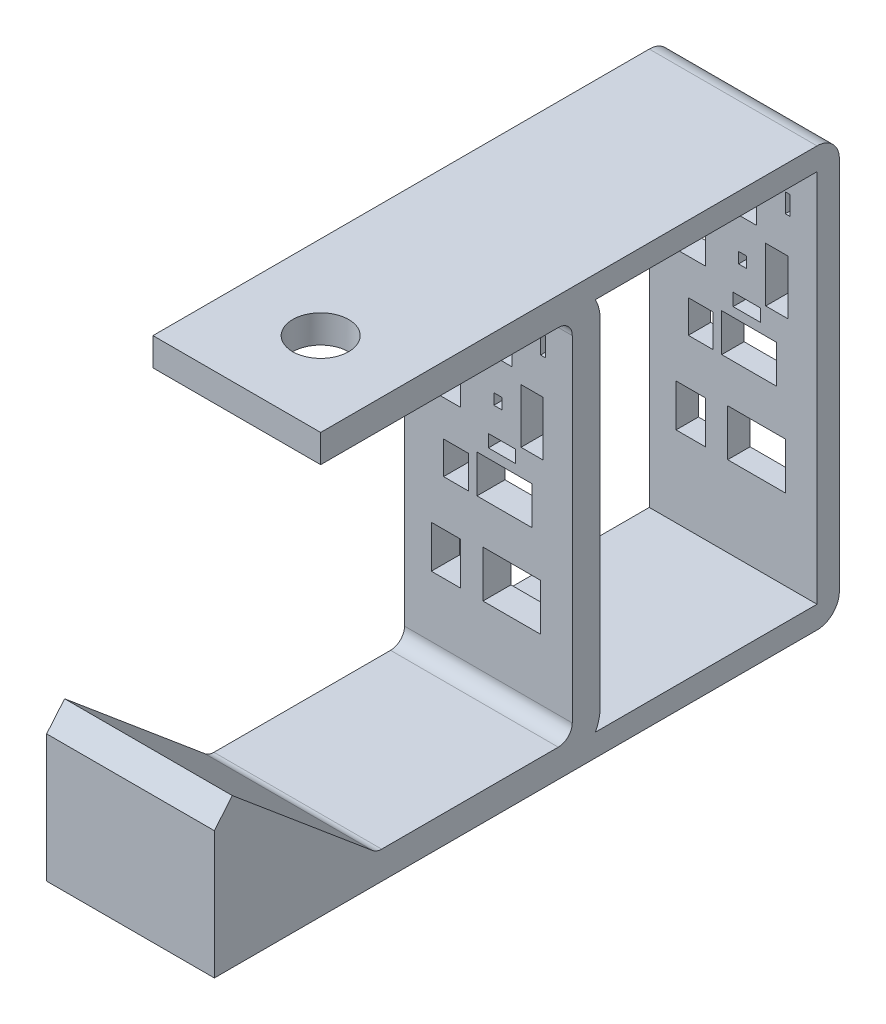
from build123d import *

# Parameters (mm, degrees)
BASE_EXTRUDE_THIN_DEPTH        = 19.05
CUT_EXTRUDE1_REACH             = 128.668
SKETCH2_R                      = 6.35
BOSS_EXTRUDE1_START            = -19.05
BOSS_EXTRUDE1_DEPTH            = 38.1
EXTRUDE_THIN1_DEPTH            = 38.1
CUT_EXTRUDE2_REACH             = 128.287
SKETCH4_W                      = 1.110971389
SKETCH4_H                      = 4.320444291
SKETCH4_W_2                    = 1.851618982
SKETCH4_H_2                    = 2.46882531
SKETCH4_W_3                    = 12.467567812
SKETCH4_H_3                    = 8.640888583
SKETCH4_W_4                    = 7.776799724
SKETCH4_H_4                    = 11.356596423
SKETCH4_W_5                    = 13.08477414
SKETCH4_H_5                    = 10.61594883
SKETCH4_W_6                    = 6.665828335
SKETCH4_H_6                    = 9.628418706
SKETCH4_W_7                    = 5.616577579
SKETCH4_H_7                    = 7.406475928
SKETCH4_W_8                    = 9.011212379
SKETCH4_H_8                    = 6.665828335
SKETCH4_W_9                    = 6.172063273
SKETCH4_H_9                    = 2.839149106
SKETCH4_W_10                   = 4.999371251
SKETCH4_H_10                   = 12.344126546
CUT_EXTRUDE2_DIRECTION_2_DEPTH = 127.286641978
FILLET1_R                      = 5.08


with BuildPart() as part:
    # Sketch1 → Base-Extrude-Thin (new, symmetric)
    with BuildSketch(Plane(origin=(0, 0, 0), x_dir=(0, 0, -1), z_dir=(1, 0, 0))):
        with BuildLine():
            Line((-77.216478592, 27.494340102), (-45.335245167, 0.742808893))
            ThreePointArc((-45.335245167, 0.742808893), (-44.380308461, 0.191475929), (-43.294394506, 0))
            Line((-43.294394506, 0), (-3.175, 0))
            ThreePointArc((-3.175, 0), (-0.92993597, 0.92993597), (0, 3.175))
            Line((0, 3.175), (0, 79.375))
            ThreePointArc((0, 79.375), (-0.92993597, 81.62006403), (-3.175, 82.55))
            Line((-3.175, 82.55), (-57.15, 82.55))
            Line((-57.15, 82.55), (-57.15, 88.9))
            Line((-57.15, 88.9), (-3.175, 88.9))
            ThreePointArc((-3.175, 88.9), (3.560192091, 86.110192091), (6.35, 79.375))
            Line((6.35, 79.375), (6.35, 3.175))
            ThreePointArc((6.35, 3.175), (3.560192091, -3.560192091), (-3.175, -6.35))
            Line((-3.175, -6.35), (-43.294394506, -6.35))
            ThreePointArc((-43.294394506, -6.35), (-46.552136371, -5.775572213), (-49.416946488, -4.121573321))
            Line((-49.416946488, -4.121573321), (-81.298179914, 22.629957888))
            Line((-81.298179914, 22.629957888), (-77.216478592, 27.494340102))
        make_face()
    extrude(amount=BASE_EXTRUDE_THIN_DEPTH, both=True)

    # Sketch2 → Cut-Extrude1 (cut, up to next)
    with BuildSketch(Plane(origin=(0, 88.9, 0), x_dir=(-1, 0, 0), z_dir=(0, 1, 0)), mode=Mode.PRIVATE) as cut_extrude1_sk1:
        with Locations(Location((0, 38.1, 0), (0, 0, 90))):
            Circle(SKETCH2_R)
    cut_extrude1_tool1 = extrude(cut_extrude1_sk1.sketch, amount=-CUT_EXTRUDE1_REACH, mode=Mode.PRIVATE) & part.part
    add(cut_extrude1_tool1.solids().sort_by_distance((0, 88.9, 38.1))[0], mode=Mode.SUBTRACT)

    # Sketch3 → Boss-Extrude1 (add)
    with BuildSketch(Plane(origin=(0, 0, 0), x_dir=(0, 0, -1), z_dir=(1, 0, 0)).offset(BOSS_EXTRUDE1_START)):
        with BuildLine():
            Line((-49.416946488, -4.121573321), (-81.298179914, 22.629957888))
            Line((-81.298179914, 22.629957888), (-81.298179914, -6.35))
            Line((-81.298179914, -6.35), (-43.294394506, -6.35))
            ThreePointArc((-43.294394506, -6.35), (-46.552136371, -5.775572213), (-49.416946488, -4.121573321))
        make_face()
    extrude(amount=BOSS_EXTRUDE1_DEPTH)

    # Sketch5 → Extrude-Thin1 (add, through all)
    with BuildSketch(Plane(origin=(19.05, 0, 0), x_dir=(0, 0, -1), z_dir=(1, 0, 0))):
        Polygon((-3.175, 88.9), (60.674508946, 88.9), (60.674508946, -6.35), (-3.175, -6.35), (-3.175, -1.27), (55.594508946, -1.27), (55.594508946, 83.82), (-3.175, 83.82), align=None)
    extrude(amount=-EXTRUDE_THIN1_DEPTH)

    # Sketch4 → Cut-Extrude2 (cut, up to next)
    with BuildSketch(Plane(origin=(0, 0, -6.35), x_dir=(-1, 0, 0), z_dir=(0, 0, -1)), mode=Mode.PRIVATE) as cut_extrude2_sk1:
        with Locations((-12.40584718, 74.110376614)):
            Rectangle(SKETCH4_W, SKETCH4_H)
    cut_extrude2_tool1 = extrude(cut_extrude2_sk1.sketch, amount=-CUT_EXTRUDE2_REACH, mode=Mode.PRIVATE) & part.part
    # Sketch4 → Cut-Extrude2 (cut, up to next)
    with BuildSketch(Plane(origin=(0, 0, -6.35), x_dir=(-1, 0, 0), z_dir=(0, 0, -1)), mode=Mode.PRIVATE) as cut_extrude2_sk2:
        with Locations((-2.160222146, 58.001291471)):
            Rectangle(SKETCH4_W_2, SKETCH4_H_2)
    cut_extrude2_tool2 = extrude(cut_extrude2_sk2.sketch, amount=-CUT_EXTRUDE2_REACH, mode=Mode.PRIVATE) & part.part
    # Sketch4 → Cut-Extrude2 (cut, up to next)
    with BuildSketch(Plane(origin=(0, 0, -6.35), x_dir=(-1, 0, 0), z_dir=(0, 0, -1)), mode=Mode.PRIVATE) as cut_extrude2_sk3:
        with Locations((-3.641517331, 41.336720633)):
            Rectangle(SKETCH4_W_3, SKETCH4_H_3)
    cut_extrude2_tool3 = extrude(cut_extrude2_sk3.sketch, amount=-CUT_EXTRUDE2_REACH, mode=Mode.PRIVATE) & part.part
    # Sketch4 → Cut-Extrude2 (cut, up to next)
    with BuildSketch(Plane(origin=(0, 0, -6.35), x_dir=(-1, 0, 0), z_dir=(0, 0, -1)), mode=Mode.PRIVATE) as cut_extrude2_sk4:
        with Locations((10.183904401, 58.248174002)):
            Rectangle(SKETCH4_W_4, SKETCH4_H_4)
    cut_extrude2_tool4 = extrude(cut_extrude2_sk4.sketch, amount=-CUT_EXTRUDE2_REACH, mode=Mode.PRIVATE) & part.part
    # Sketch4 → Cut-Extrude2 (cut, up to next)
    with BuildSketch(Plane(origin=(0, 0, -6.35), x_dir=(-1, 0, 0), z_dir=(0, 0, -1)), mode=Mode.PRIVATE) as cut_extrude2_sk5:
        with Locations((-5.307974415, 22.326765751)):
            Rectangle(SKETCH4_W_5, SKETCH4_H_5)
    cut_extrude2_tool5 = extrude(cut_extrude2_sk5.sketch, amount=-CUT_EXTRUDE2_REACH, mode=Mode.PRIVATE) & part.part
    # Sketch4 → Cut-Extrude2 (cut, up to next)
    with BuildSketch(Plane(origin=(0, 0, -6.35), x_dir=(-1, 0, 0), z_dir=(0, 0, -1)), mode=Mode.PRIVATE) as cut_extrude2_sk6:
        with Locations((9.628418706, 21.833000689)):
            Rectangle(SKETCH4_W_6, SKETCH4_H_6)
    cut_extrude2_tool6 = extrude(cut_extrude2_sk6.sketch, amount=-CUT_EXTRUDE2_REACH, mode=Mode.PRIVATE) & part.part
    # Sketch4 → Cut-Extrude2 (cut, up to next)
    with BuildSketch(Plane(origin=(0, 0, -6.35), x_dir=(-1, 0, 0), z_dir=(0, 0, -1)), mode=Mode.PRIVATE) as cut_extrude2_sk7:
        with Locations((7.375615612, 40.719514305)):
            Rectangle(SKETCH4_W_7, SKETCH4_H_7)
    cut_extrude2_tool7 = extrude(cut_extrude2_sk7.sketch, amount=-CUT_EXTRUDE2_REACH, mode=Mode.PRIVATE) & part.part
    # Sketch4 → Cut-Extrude2 (cut, up to next)
    with BuildSketch(Plane(origin=(0, 0, -6.35), x_dir=(-1, 0, 0), z_dir=(0, 0, -1)), mode=Mode.PRIVATE) as cut_extrude2_sk8:
        with Locations((-0.802368225, 69.728211691)):
            Rectangle(SKETCH4_W_8, SKETCH4_H_8)
    cut_extrude2_tool8 = extrude(cut_extrude2_sk8.sketch, amount=-CUT_EXTRUDE2_REACH, mode=Mode.PRIVATE) & part.part
    # Sketch4 → Cut-Extrude2 (cut, up to next)
    with BuildSketch(Plane(origin=(0, 0, -6.35), x_dir=(-1, 0, 0), z_dir=(0, 0, -1)), mode=Mode.PRIVATE) as cut_extrude2_sk9:
        with Locations((-3.086031637, 49.17524099)):
            Rectangle(SKETCH4_W_9, SKETCH4_H_9)
    cut_extrude2_tool9 = extrude(cut_extrude2_sk9.sketch, amount=-CUT_EXTRUDE2_REACH, mode=Mode.PRIVATE) & part.part
    # Sketch4 → Cut-Extrude2 (cut, up to next)
    with BuildSketch(Plane(origin=(0, 0, -6.35), x_dir=(-1, 0, 0), z_dir=(0, 0, -1)), mode=Mode.PRIVATE) as cut_extrude2_sk10:
        with Locations((-9.906161554, 57.75440894)):
            Rectangle(SKETCH4_W_10, SKETCH4_H_10)
    cut_extrude2_tool10 = extrude(cut_extrude2_sk10.sketch, amount=-CUT_EXTRUDE2_REACH, mode=Mode.PRIVATE) & part.part
    add(cut_extrude2_tool1.solids().sort_by_distance((12.405847, 74.110377, -6.35))[0], mode=Mode.SUBTRACT)
    add(cut_extrude2_tool2.solids().sort_by_distance((2.160222, 58.001291, -6.35))[0], mode=Mode.SUBTRACT)
    add(cut_extrude2_tool3.solids().sort_by_distance((3.641517, 41.336721, -6.35))[0], mode=Mode.SUBTRACT)
    add(cut_extrude2_tool4.solids().sort_by_distance((-10.183904, 58.248174, -6.35))[0], mode=Mode.SUBTRACT)
    add(cut_extrude2_tool5.solids().sort_by_distance((5.307974, 22.326766, -6.35))[0], mode=Mode.SUBTRACT)
    add(cut_extrude2_tool6.solids().sort_by_distance((-9.628419, 21.833001, -6.35))[0], mode=Mode.SUBTRACT)
    add(cut_extrude2_tool7.solids().sort_by_distance((-7.375616, 40.719514, -6.35))[0], mode=Mode.SUBTRACT)
    add(cut_extrude2_tool8.solids().sort_by_distance((0.802368, 69.728212, -6.35))[0], mode=Mode.SUBTRACT)
    add(cut_extrude2_tool9.solids().sort_by_distance((3.086032, 49.175241, -6.35))[0], mode=Mode.SUBTRACT)
    add(cut_extrude2_tool10.solids().sort_by_distance((9.906162, 57.754409, -6.35))[0], mode=Mode.SUBTRACT)

    # Sketch4 → Cut-Extrude2 direction 2 (cut)
    with BuildSketch(Plane(origin=(0, 0, -6.35), x_dir=(-1, 0, 0), z_dir=(0, 0, -1))):
        with Locations((-12.40584718, 74.110376614)):
            Rectangle(SKETCH4_W, SKETCH4_H)
        with Locations((-2.160222146, 58.001291471)):
            Rectangle(SKETCH4_W_2, SKETCH4_H_2)
        with Locations((-3.641517331, 41.336720633)):
            Rectangle(SKETCH4_W_3, SKETCH4_H_3)
        with Locations((10.183904401, 58.248174002)):
            Rectangle(SKETCH4_W_4, SKETCH4_H_4)
        with Locations((-5.307974415, 22.326765751)):
            Rectangle(SKETCH4_W_5, SKETCH4_H_5)
        with Locations((9.628418706, 21.833000689)):
            Rectangle(SKETCH4_W_6, SKETCH4_H_6)
        with Locations((7.375615612, 40.719514305)):
            Rectangle(SKETCH4_W_7, SKETCH4_H_7)
        with Locations((-0.802368225, 69.728211691)):
            Rectangle(SKETCH4_W_8, SKETCH4_H_8)
        with Locations((-3.086031637, 49.17524099)):
            Rectangle(SKETCH4_W_9, SKETCH4_H_9)
        with Locations((-9.906161554, 57.75440894)):
            Rectangle(SKETCH4_W_10, SKETCH4_H_10)
    extrude(amount=CUT_EXTRUDE2_DIRECTION_2_DEPTH, mode=Mode.SUBTRACT)

    # Fillet1
    fillet1_edges = [part.edges().sort_by_distance(p)[0] for p in [
        (0, 88.9, -60.674508946),
        (0, -6.35, -60.674508946),
    ]]
    fillet(fillet1_edges, radius=FILLET1_R)


solid = part.part
